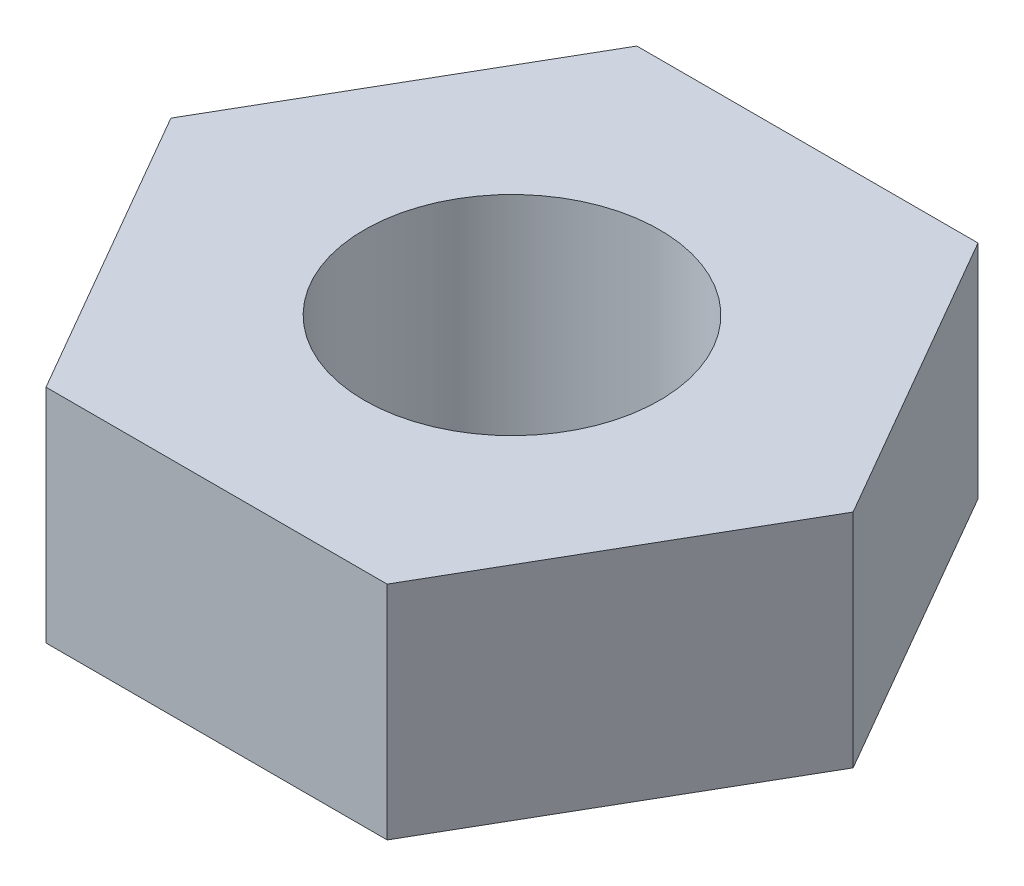
from build123d import *

# Parameters (mm, degrees)
SKETCH1_R           = 2
BOSS_EXTRUDE1_DEPTH = 3


with BuildPart() as part:
    # Sketch1 → Boss-Extrude1 (new body)
    with BuildSketch(Plane(origin=(0, 0, 0), x_dir=(1, 0, 0), z_dir=(0, 1, 0))):
        Polygon((-4.618802154, 0), (-2.309401077, -4), (2.309401077, -4), (4.618802154, 0), (2.309401077, 4), (-2.309401077, 4), align=None)
        with Locations(Location((0, 0, 0), (0, 0, 270))):
            Circle(SKETCH1_R, mode=Mode.SUBTRACT)
    extrude(amount=BOSS_EXTRUDE1_DEPTH)


solid = part.part
